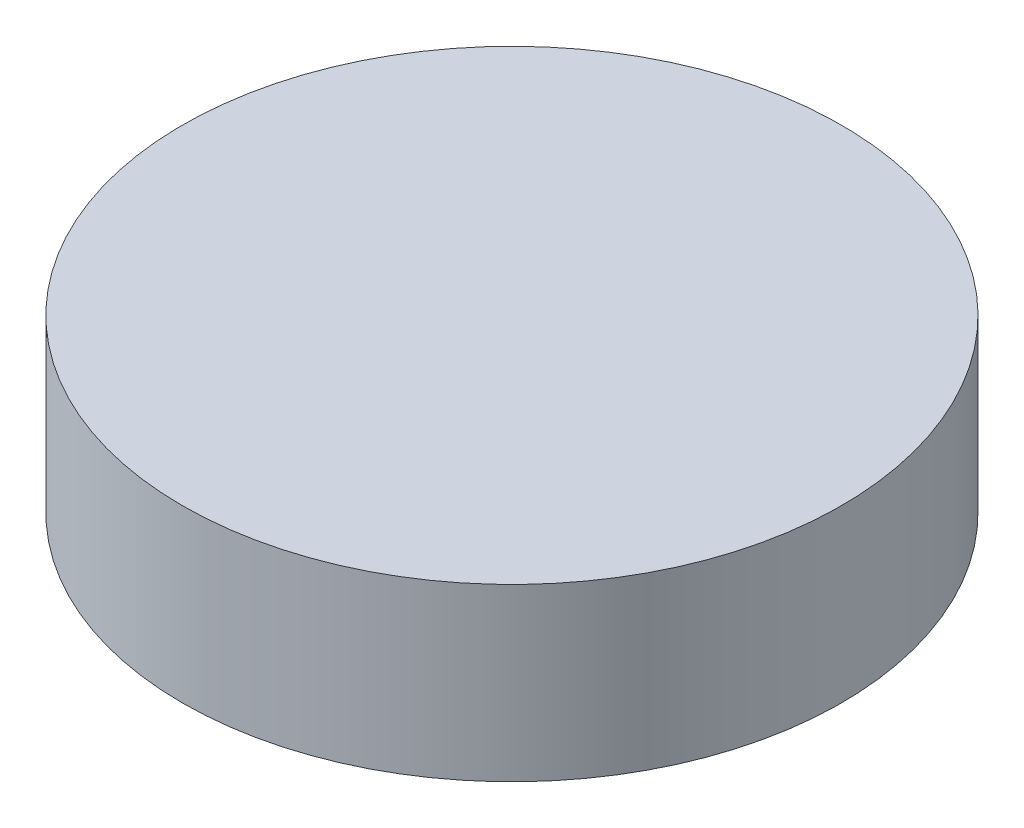
from build123d import *

# Parameters (mm, degrees)
ESBO_O1_R                = 13.5
RESSALTO_EXTRUS_O1_DEPTH = 7


with BuildPart() as part:
    # Esboço1 → Ressalto-extrusão1 (new body)
    with BuildSketch(Plane(origin=(0, 0, 0), x_dir=(1, 0, 0), z_dir=(0, 1, 0))):
        with Locations(Location((0, 0, 0), (0, 0, 270))):
            Circle(ESBO_O1_R)
    extrude(amount=RESSALTO_EXTRUS_O1_DEPTH)


solid = part.part
